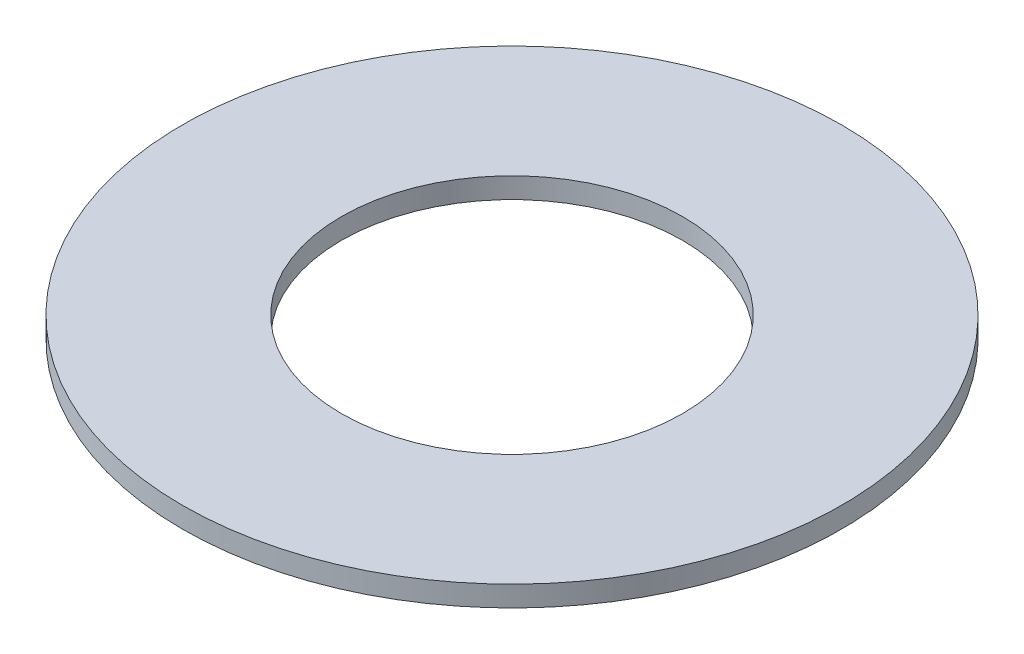
from build123d import *

# Parameters (mm, degrees)
SKETCH1_R           = 76
SKETCH1_R_2         = 39.35
BOSS_EXTRUDE1_DEPTH = 4.76


with BuildPart() as part:
    # Sketch1 → Boss-Extrude1 (new body)
    with BuildSketch(Plane(origin=(0, 0, 0), x_dir=(1, 0, 0), z_dir=(0, 1, 0))):
        with Locations(Location((0, 0, 0), (0, 0, 270))):
            Circle(SKETCH1_R)
        with Locations(Location((0, 0, 0), (0, 0, 270))):
            Circle(SKETCH1_R_2, mode=Mode.SUBTRACT)
    extrude(amount=BOSS_EXTRUDE1_DEPTH)


solid = part.part
